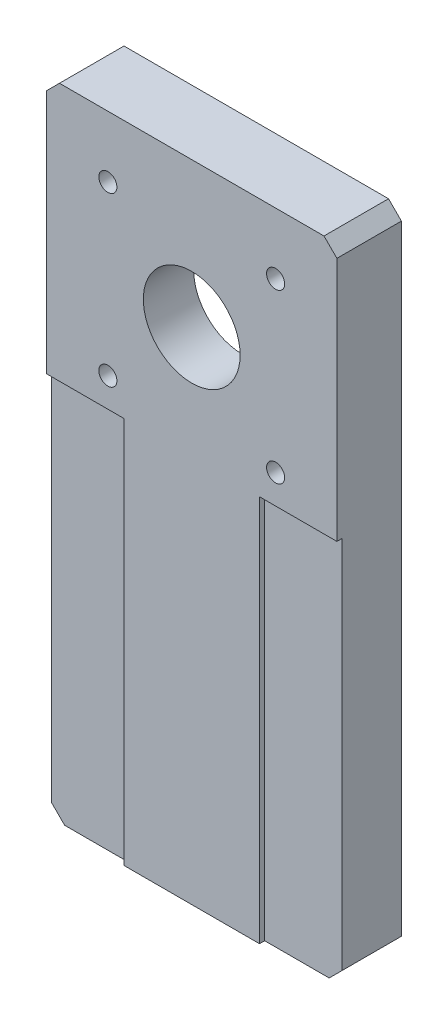
from build123d import *

# Parameters (mm, degrees)
SKETCH1_W           = 45
SKETCH1_H           = 100
BOSS_EXTRUDE1_DEPTH = 10
SKETCH3_R           = 7.5
SKETCH3_R_2         = 1.4
CUT_EXTRUDE1_DEPTH  = 10
SKETCH4_R           = 11
CUT_EXTRUDE2_DEPTH  = 2.2
SKETCH5_W           = 12
SKETCH5_H           = 0.8
CUT_EXTRUDE3_DEPTH  = 60
CHAMFER1_SIZE       = 2


with BuildPart() as part:
    # Sketch1 → Boss-Extrude1 (new body)
    with BuildSketch(Plane.XY):
        with Locations((22.5, 50)):
            Rectangle(SKETCH1_W, SKETCH1_H)
    extrude(amount=BOSS_EXTRUDE1_DEPTH)

    # Sketch3 → Cut-Extrude1 (cut)
    with BuildSketch(Plane.XY.offset(10)):
        with Locations((22.5, 77.5)):
            Circle(SKETCH3_R)
        with Locations((9.5, 90.5)):
            Circle(SKETCH3_R_2)
        with Locations((35.5, 90.5)):
            Circle(SKETCH3_R_2)
        with Locations((35.5, 64.5)):
            Circle(SKETCH3_R_2)
        with Locations((9.5, 64.5)):
            Circle(SKETCH3_R_2)
    extrude(amount=-CUT_EXTRUDE1_DEPTH, mode=Mode.SUBTRACT)

    # Sketch4 → Cut-Extrude2 (cut)
    with BuildSketch(Plane(origin=(0, 0, 0), x_dir=(-1, 0, 0), z_dir=(0, 0, -1))):
        with Locations((-22.5, 77.5)):
            Circle(SKETCH4_R)
    extrude(amount=-CUT_EXTRUDE2_DEPTH, mode=Mode.SUBTRACT)

    # Sketch5 → Cut-Extrude3 (cut)
    with BuildSketch(Plane.XZ):
        with Locations((6, 9.6)):
            Rectangle(SKETCH5_W, SKETCH5_H)
        with Locations((39, 9.6)):
            Rectangle(SKETCH5_W, SKETCH5_H)
    extrude(amount=-CUT_EXTRUDE3_DEPTH, mode=Mode.SUBTRACT)

    # Chamfer1
    chamfer1_edges = [part.edges().sort_by_distance(p)[0] for p in [
        (45, 0, 4.6),
        (0, 0, 4.6),
        (0, 100, 5),
        (45, 100, 5),
    ]]
    chamfer(chamfer1_edges, length=CHAMFER1_SIZE)


solid = part.part
